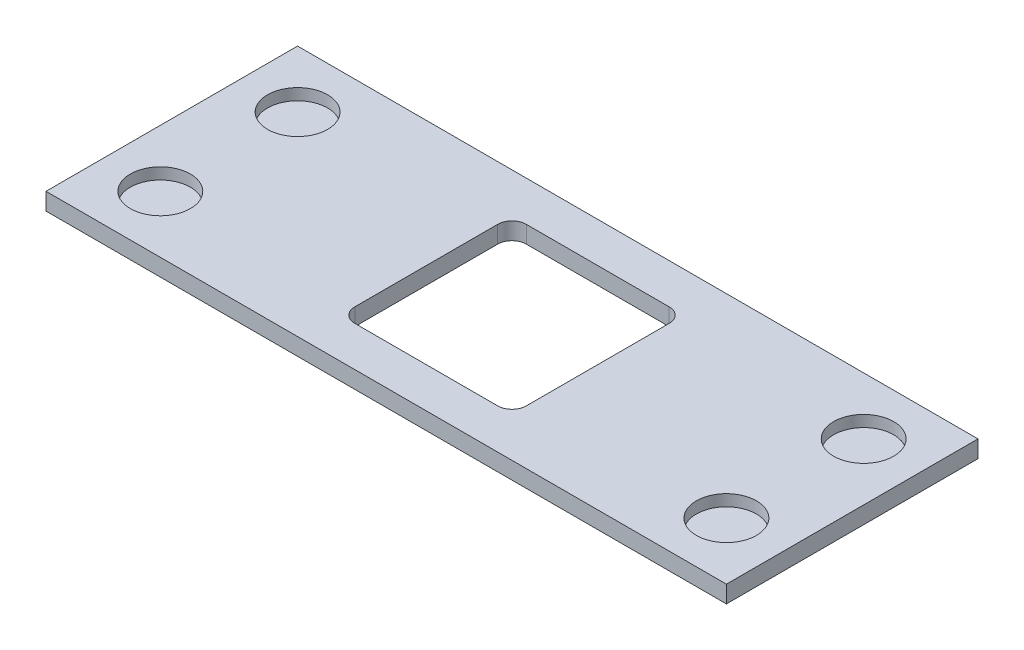
from build123d import *

# Parameters (mm, degrees)
ESBO_O1_W                 = 119
ESBO_O1_H                 = 44
EXTRUS_O1_DEPTH           = 3
ESBO_O2_R                 = 5.25
EXTRUS_O2_DEPTH           = 2
ESPELHAR2_COPY_1_SKETCH_R = 5.25
ESPELHAR2_COPY_1_DEPTH    = 2
EXTRUS_O3_DEPTH           = 3


with BuildPart() as part:
    # Esboço1 → Extrusão1 (new body)
    with BuildSketch(Plane(origin=(0, 0, 0), x_dir=(1, 0, 0), z_dir=(0, 1, 0))):
        Rectangle(ESBO_O1_W, ESBO_O1_H)
    extrude(amount=EXTRUS_O1_DEPTH)

    # Esboço2 → Extrusão2 (cut)
    with BuildSketch(Plane(origin=(0, 3, 0), x_dir=(1, 0, 0), z_dir=(0, 1, 0))):
        with Locations(Location((-49.5, 12, 0), (0, 0, 270))):
            Circle(ESBO_O2_R)
    extrus_o2 = extrude(amount=-EXTRUS_O2_DEPTH, mode=Mode.SUBTRACT)

    # Espelhar1: Extrusão2 across plane
    add(extrus_o2.mirror(Plane(origin=(0, 0, 0), x_dir=(0, 0, 1), z_dir=(1, 0, 0))), mode=Mode.SUBTRACT)

    # Espelhar2: Extrusão2 across plane
    add(extrus_o2.mirror(Plane.XY), mode=Mode.SUBTRACT)

    # Espelhar2 copy 1 sketch → Espelhar2 copy 1 (cut)
    with BuildSketch(Plane(origin=(0, 3, 0), x_dir=(-1, 0, 0), z_dir=(0, 1, 0))):
        with Locations(Location((-49.5, 12, 0), (0, 0, 270))):
            Circle(ESPELHAR2_COPY_1_SKETCH_R)
    extrude(amount=-ESPELHAR2_COPY_1_DEPTH, mode=Mode.SUBTRACT)

    # Esboço3 → Extrusão3 (cut)
    with BuildSketch(Plane(origin=(0, 3, 0), x_dir=(1, 0, 0), z_dir=(0, 1, 0))):
        with BuildLine():
            Line((-12.5, 15), (12.5, 15))
            ThreePointArc((12.5, 15), (14.267766953, 14.267766953), (15, 12.5))
            Line((15, 12.5), (15, -12.5))
            ThreePointArc((15, -12.5), (14.267766953, -14.267766953), (12.5, -15))
            Line((12.5, -15), (-12.5, -15))
            ThreePointArc((-12.5, -15), (-14.267766953, -14.267766953), (-15, -12.5))
            Line((-15, -12.5), (-15, 12.5))
            ThreePointArc((-15, 12.5), (-14.267766953, 14.267766953), (-12.5, 15))
        make_face()
    extrude(amount=-EXTRUS_O3_DEPTH, mode=Mode.SUBTRACT)


solid = part.part
